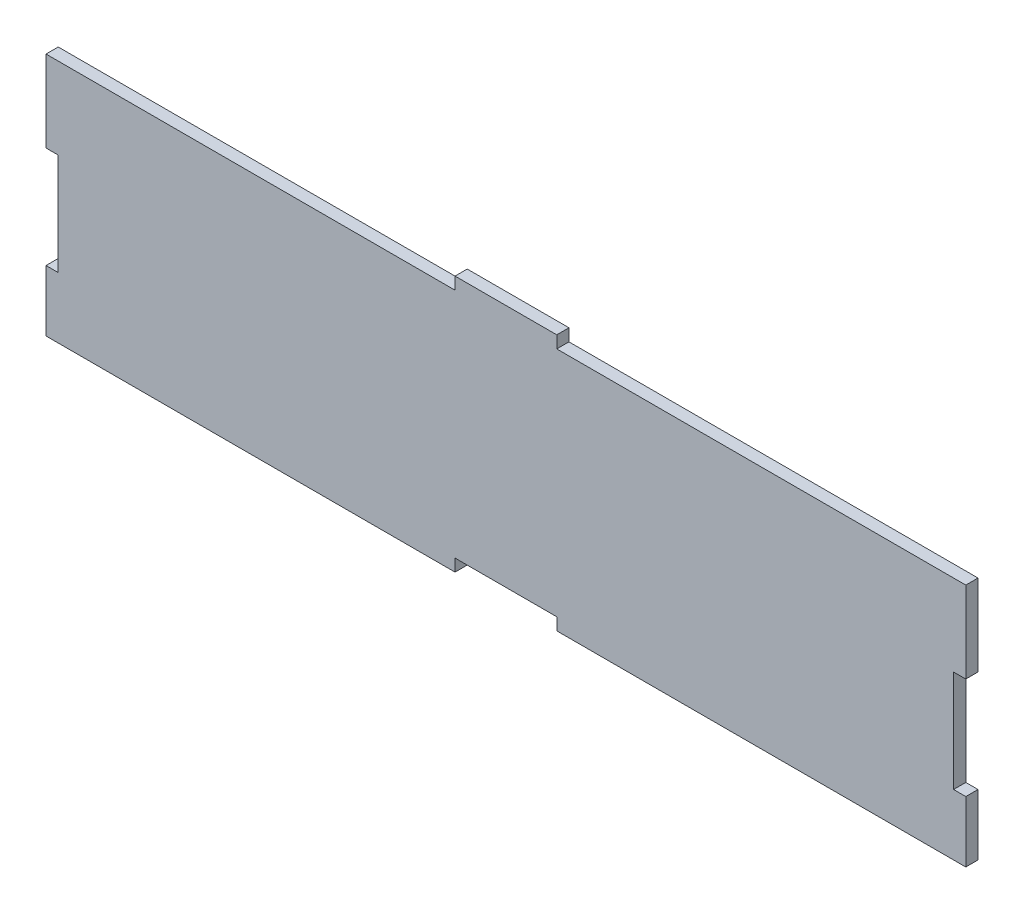
from build123d import *

# Parameters (mm, degrees)
EXTRUDE_1_DEPTH = 3


with BuildPart() as part:
    # Эскиз1 → Бобышка-Вытянуть1 (new body)
    with BuildSketch(Plane.XY):
        Polygon((-92.315323093, -63.989361702), (-92.315323093, -78.989361702), (8.184676907, -78.989361702), (8.184676907, -75.989361702), (33.184676907, -75.989361702), (33.184676907, -78.989361702), (133.684676907, -78.989361702), (133.684676907, -63.989361702), (130.684676907, -63.989361702), (130.684676907, -38.989361702), (133.684676907, -38.989361702), (133.684676907, -18.989361702), (33.184676907, -18.989361702), (33.184676907, -15.989361702), (8.184676907, -15.989361702), (8.184676907, -18.989361702), (-92.315323093, -18.989361702), (-92.315323093, -38.989361702), (-89.315323093, -38.989361702), (-89.315323093, -63.989361702), align=None)
    extrude(amount=EXTRUDE_1_DEPTH)


solid = part.part
